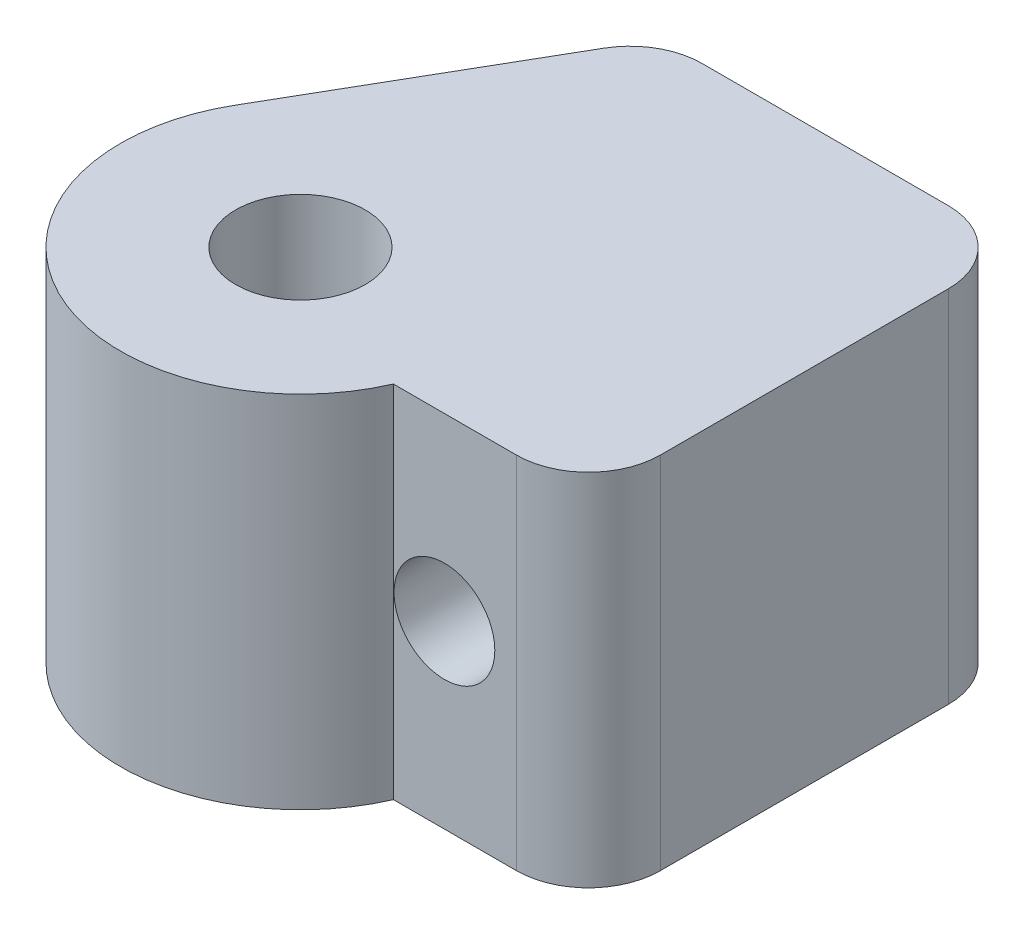
from build123d import *

# Parameters (mm, degrees)
SKETCH1_R           = 2.286
BOSS_EXTRUDE1_DEPTH = 12.7
SKETCH2_R           = 1.778
CUT_EXTRUDE1_DEPTH  = 24.554990979
FILLET1_R           = 2.54


with BuildPart() as part:
    # Sketch1 → Boss-Extrude1 (new body)
    with BuildSketch(Plane(origin=(0, 0, 0), x_dir=(1, 0, 0), z_dir=(0, 1, 0))):
        with BuildLine():
            Line((-5.499261314, 3.175), (0, 12.7))
            Line((0, 12.7), (12.7, 12.7))
            Line((12.7, 12.7), (12.7, -2.54))
            Line((12.7, -2.54), (5.819871133, -2.54))
            ThreePointArc((5.819871133, -2.54), (-2.861992997, -5.668465056), (-5.499261314, 3.175))
        make_face()
        with Locations(Location((0, 0, 0), (0, 0, 270))):
            Circle(SKETCH1_R, mode=Mode.SUBTRACT)
    extrude(amount=BOSS_EXTRUDE1_DEPTH)

    # Sketch2 → Cut-Extrude1 (cut, through all)
    with BuildSketch(Plane.XY.offset(2.54)):
        with Locations((7.62, 6.35)):
            Circle(SKETCH2_R)
    extrude(amount=-CUT_EXTRUDE1_DEPTH, mode=Mode.SUBTRACT)

    # Fillet1
    fillet1_edges = [part.edges().sort_by_distance(p)[0] for p in [
        (0, 6.35, -12.7),
        (12.7, 6.35, -12.7),
        (12.7, 6.35, 2.54),
    ]]
    fillet(fillet1_edges, radius=FILLET1_R)


solid = part.part
